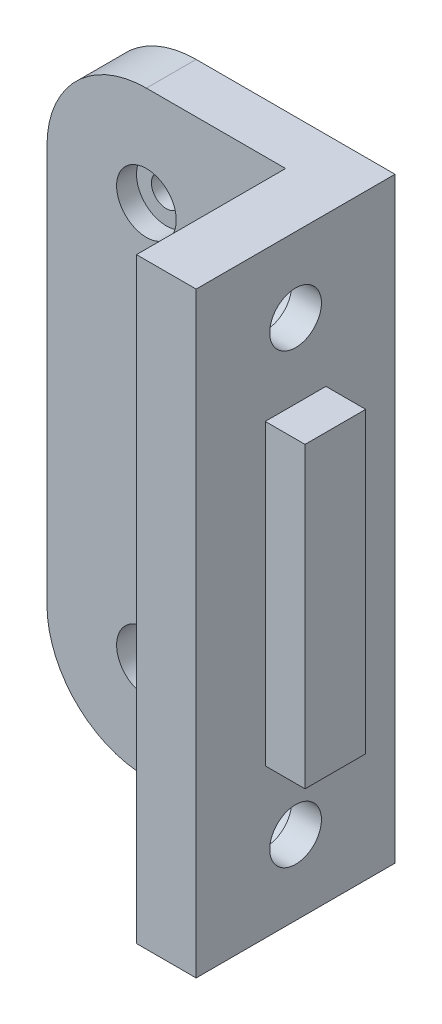
from build123d import *

# Parameters (mm, degrees)
SKETCH_1_W          = 20
SKETCH_1_H          = 20
EXTRUDE_1_DEPTH     = 90
SKETCH_2_W          = 20
SKETCH_2_H          = 90
EXTRUDE_2_DEPTH     = 20
SKETCH_4_W          = 34
SKETCH_4_H          = 90
CUT_EXTRUDE_1_DEPTH = 15
CUT_EXTRUDE_2_DEPTH = 15
SKETCH_8_R          = 5
CUT_EXTRUDE_3_DEPTH = 3
SKETCH_9_R          = 1.5
CUT_EXTRUDE_4_DEPTH = 5
CUT_EXTRUDE_5_DEPTH = 40
EXTRUDE_3_DEPTH     = 4
SKETCH_12_R         = 3
CUT_EXTRUDE_6_DEPTH = 2


with BuildPart() as part:
    # 草图1 → 凸台-拉伸1 (new body)
    with BuildSketch(Plane(origin=(0, 0, 0), x_dir=(1, 0, 0), z_dir=(0, 1, 0))):
        with Locations((10, -10)):
            Rectangle(SKETCH_1_W, SKETCH_1_H)
    extrude(amount=EXTRUDE_1_DEPTH)

    # 草图2 → 凸台-拉伸2 (add)
    with BuildSketch(Plane(origin=(0, 0, 0), x_dir=(-1, 0, 0), z_dir=(0, 0, -1))):
        with Locations((10, 45)):
            Rectangle(SKETCH_2_W, SKETCH_2_H)
    extrude(amount=-EXTRUDE_2_DEPTH)

    # 草图4 → 切除-拉伸1 (cut)
    with BuildSketch(Plane.XY.offset(20)):
        with Locations((-3, 45)):
            Rectangle(SKETCH_4_W, SKETCH_4_H)
    extrude(amount=-CUT_EXTRUDE_1_DEPTH, mode=Mode.SUBTRACT)

    # 草图6 → 切除-拉伸2 (cut)
    with BuildSketch(Plane(origin=(20, 0, 0), x_dir=(0, 0, -1), z_dir=(1, 0, 0))):
        with BuildLine():
            ThreePointArc((-10, 70.1), (-12.6, 67.5), (-10, 64.9))
            Line((-10, 64.9), (-10, 70.1))
        make_face()
        with BuildLine():
            Line((-10, 70.1), (-10, 64.9))
            ThreePointArc((-10, 64.9), (-8.161522369, 65.661522369), (-7.4, 67.5))
            ThreePointArc((-7.4, 67.5), (-8.161522369, 69.338477631), (-10, 70.1))
        make_face()
        with BuildLine():
            ThreePointArc((-7.4, 22.5), (-8.161522369, 24.338477631), (-10, 25.1))
            Line((-10, 25.1), (-10, 19.9))
            ThreePointArc((-10, 19.9), (-8.161522369, 20.661522369), (-7.4, 22.5))
        make_face()
        with BuildLine():
            Line((-10, 19.9), (-10, 25.1))
            ThreePointArc((-10, 25.1), (-12.6, 22.5), (-10, 19.9))
        make_face()
    extrude(amount=-CUT_EXTRUDE_2_DEPTH, mode=Mode.SUBTRACT)

    # 草图8 → 切除-拉伸3 (cut)
    with BuildSketch(Plane.ZY.offset(-14)):
        with Locations(Location((10, 67.5, 0), (0, 0, 270))):
            Circle(SKETCH_8_R)
        with Locations(Location((10, 22.5, 0), (0, 0, 270))):
            Circle(SKETCH_8_R)
    extrude(amount=-CUT_EXTRUDE_3_DEPTH, mode=Mode.SUBTRACT)

    # 草图9 → 切除-拉伸4 (cut)
    with BuildSketch(Plane.XY.offset(5)):
        with Locations((10, 65)):
            Circle(SKETCH_9_R)
        with Locations((10, 25)):
            Circle(SKETCH_9_R)
        with Locations((0, 65)):
            Circle(SKETCH_9_R)
        with Locations((0, 25)):
            Circle(SKETCH_9_R)
    extrude(amount=-CUT_EXTRUDE_4_DEPTH, mode=Mode.SUBTRACT)

    # 草图10 → 切除-拉伸5 (cut)
    with BuildSketch(Plane(origin=(0, 0, 0), x_dir=(-1, 0, 0), z_dir=(0, 0, -1))):
        with BuildLine():
            Line((0, 15), (-20, 15))
            Line((-20, 15), (-20, 0))
            Line((-20, 0), (20, 0))
            Line((20, 0), (20, 90))
            Line((20, 90), (-20, 90))
            Line((-20, 90), (-20, 75))
            Line((-20, 75), (0, 75))
            ThreePointArc((0, 75), (7.071067812, 72.071067812), (10, 65))
            Line((10, 65), (10, 25))
            ThreePointArc((10, 25), (7.071067812, 17.928932188), (0, 15))
        make_face()
    extrude(amount=-CUT_EXTRUDE_5_DEPTH, mode=Mode.SUBTRACT)

    # 草图11 → 凸台-拉伸3 (add)
    with BuildSketch(Plane(origin=(20, 0, 0), x_dir=(0, 0, -1), z_dir=(1, 0, 0))):
        Polygon((-6.95, 60), (-10, 60), (-13.05, 60), (-13.05, 30), (-10, 30), (-6.95, 30), align=None)
    extrude(amount=EXTRUDE_3_DEPTH)

    # 草图12 → 切除-拉伸6 (cut)
    with BuildSketch(Plane.XY.offset(5)):
        with Locations((0, 65)):
            Circle(SKETCH_12_R)
        with Locations((10, 65)):
            Circle(SKETCH_12_R)
        with Locations((0, 25)):
            Circle(SKETCH_12_R)
        with Locations((10, 25)):
            Circle(SKETCH_12_R)
    extrude(amount=-CUT_EXTRUDE_6_DEPTH, mode=Mode.SUBTRACT)


solid = part.part
